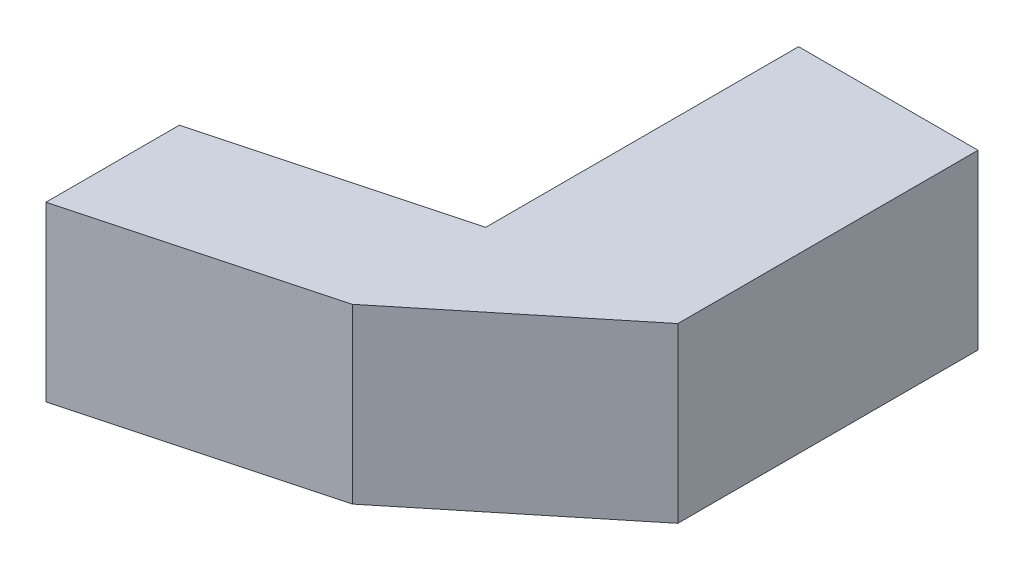
from build123d import *

# Parameters (mm, degrees)
SKETCH1_W           = 10.758936
SKETCH1_H           = 10.375
SKETCH1_W_2         = 6.758936
SKETCH1_H_2         = 6.375
BOSS_EXTRUDE1_DEPTH = 18
BOSS_EXTRUDE2_DEPTH = 2
BOSS_EXTRUDE3_REACH = 21.49
SKETCH3_W           = 10.758936
SKETCH3_H           = 10.375
SKETCH3_W_2         = 6.758936
SKETCH3_H_2         = 6.375
BOSS_EXTRUDE7_DEPTH = 10.375
BOSS_EXTRUDE8_DEPTH = 10.375


with BuildPart() as part:
    # Sketch1 → Boss-Extrude1 (new body)
    with BuildSketch(Plane.XY):
        Rectangle(SKETCH1_W, SKETCH1_H)
        Rectangle(SKETCH1_W_2, SKETCH1_H_2, mode=Mode.SUBTRACT)
    extrude(amount=BOSS_EXTRUDE1_DEPTH)

    # Sketch2 → Boss-Extrude2 (add)
    with BuildSketch(Plane(origin=(0, -3.1875, 0), x_dir=(1, 0, 0), z_dir=(0, 1, 0))):
        Polygon((3.379468, -18), (-3.550178456, -24.929646456), (-3.379468, -18), align=None)
    extrude(amount=-BOSS_EXTRUDE2_DEPTH)

    # Boss-Extrude3: up to this face of the body (flat: up to its plane)
    boss_extrude3_end = Plane(part.part.faces().sort_by_distance((-0.085355228, -4.1875, 21.464823228))[0])
    # Sketch3 → Boss-Extrude3 (add, up to the picked face)
    with BuildSketch(Plane.XY.offset(18), mode=Mode.PRIVATE) as boss_extrude3_sk1:
        Rectangle(SKETCH3_W, SKETCH3_H)
        Rectangle(SKETCH3_W_2, SKETCH3_H_2, mode=Mode.SUBTRACT)
    boss_extrude3_tool1 = split(extrude(boss_extrude3_sk1.sketch, amount=BOSS_EXTRUDE3_REACH, mode=Mode.PRIVATE), bisect_by=boss_extrude3_end, keep=Keep.BOTH, mode=Mode.PRIVATE)
    add(boss_extrude3_tool1.solids().sort_by(Axis((0, -5.038036, 18), (0, 0, 1)))[0])

    # Sketch7 → Boss-Extrude7 (add)
    with BuildSketch(Plane(origin=(0, -5.1875, 0), x_dir=(-1, 0, 0), z_dir=(0, -1, 0))):
        Polygon((5.379468, -26.758936), (19.868355394, -30.641221677), (19.868355394, -22.641221677), (5.379468, -18.758936), align=None)
    extrude(amount=-BOSS_EXTRUDE7_DEPTH)

    # Sketch8 → Boss-Extrude8 (add)
    with BuildSketch(Plane(origin=(0, -5.1875, 0), x_dir=(-1, 0, 0), z_dir=(0, -1, 0))):
        Polygon((5.379468, -26.758936), (-5.379468, -18), (-3.379468, -18), align=None)
    extrude(amount=-BOSS_EXTRUDE8_DEPTH)


solid = part.part
